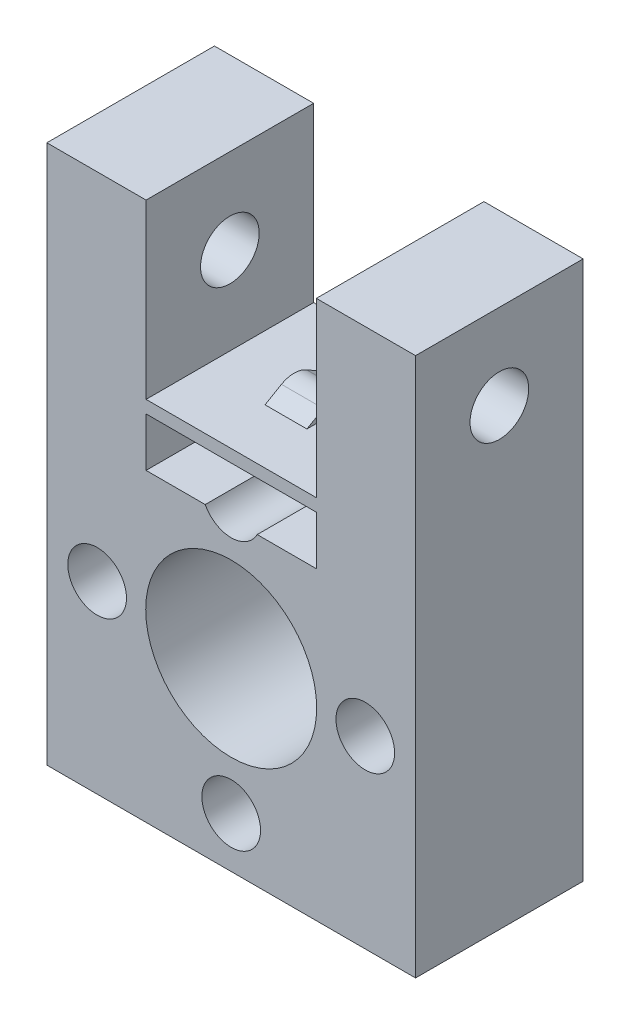
from build123d import *

# Parameters (mm, degrees)
SKETCH1_R                       = 11
SKETCH1_R_2                     = 5.1
BOSS_EXTRUDE1_DEPTH             = 10
SKETCH2_R                       = 1.75
CUT_EXTRUDE1_DEPTH              = 19.493242009
BOSS_EXTRUDE2_START             = 11
SKETCH3_W                       = 22
SKETCH3_H                       = 10
BOSS_EXTRUDE2_DEPTH             = 10.16
BOSS_EXTRUDE3_REACH             = 28.552
SKETCH5_W                       = 22
SKETCH5_H                       = 10
SKETCH6_W                       = 10.16
SKETCH6_H                       = 13.97
CUT_EXTRUDE2_DEPTH              = 26.860116009
SKETCH7_R                       = 1.75
CUT_EXTRUDE3_DEPTH              = 33.120797001
BOSS_EXTRUDE4_DEPTH             = 10
BOSS_EXTRUDE5_REACH             = 27.86
SKETCH9_W                       = 10
SKETCH9_H                       = 0.75
BOSS_EXTRUDE5_DIRECTION_2_REACH = 27.86
BOSS_EXTRUDE6_DEPTH             = 1.25
FILLET1_R                       = 1.5


with BuildPart() as part:
    # Sketch1 → Boss-Extrude1 (new body)
    with BuildSketch(Plane.XY):
        Circle(SKETCH1_R)
        Circle(SKETCH1_R_2, mode=Mode.SUBTRACT)
    extrude(amount=BOSS_EXTRUDE1_DEPTH)

    # Sketch2 → Cut-Extrude1 (cut, through all)
    with BuildSketch(Plane.XY.offset(10)):
        with Locations((0, 8)):
            Circle(SKETCH2_R)
        with Locations((8, 0)):
            Circle(SKETCH2_R)
        with Locations((0, -8)):
            Circle(SKETCH2_R)
        with Locations((-8, 0)):
            Circle(SKETCH2_R)
    extrude(amount=-CUT_EXTRUDE1_DEPTH, mode=Mode.SUBTRACT)

    # Sketch5 → Boss-Extrude3 (add, up to next)
    with BuildSketch(Plane.XZ.offset(-11), mode=Mode.PRIVATE) as boss_extrude3_sk1:
        with Locations((0, 5)):
            Rectangle(SKETCH5_W, SKETCH5_H)
    boss_extrude3_tool1 = extrude(boss_extrude3_sk1.sketch, amount=BOSS_EXTRUDE3_REACH, mode=Mode.PRIVATE) - part.part


with BuildPart() as body_2:
    # Sketch3 → Boss-Extrude2 (new body)
    with BuildSketch(Plane(origin=(0, 0, 0), x_dir=(1, 0, 0), z_dir=(0, 1, 0)).offset(BOSS_EXTRUDE2_START)):
        with Locations((0, -5)):
            Rectangle(SKETCH3_W, SKETCH3_H)
    extrude(amount=BOSS_EXTRUDE2_DEPTH)


with BuildPart() as part_1:
    add(part.part)

    add(body_2.part)  # Boss-Extrude3 merges body 2
    add(boss_extrude3_tool1.solids().sort_by_distance((0, 11, 5))[0])
    add(boss_extrude3_tool1.solids().sort_by_distance((0, 11, 5))[1])

    # Sketch6 → Cut-Extrude2 (cut, through all)
    with BuildSketch(Plane.XY.offset(10)):
        with Locations((0, 14.175)):
            Rectangle(SKETCH6_W, SKETCH6_H)
    extrude(amount=-CUT_EXTRUDE2_DEPTH, mode=Mode.SUBTRACT)

    # Sketch7 → Cut-Extrude3 (cut, through all)
    with BuildSketch(Plane(origin=(11, 0, 0), x_dir=(0, 0, -1), z_dir=(1, 0, 0))):
        with Locations((-5, 16.08)):
            Circle(SKETCH7_R)
    extrude(amount=-CUT_EXTRUDE3_DEPTH, mode=Mode.SUBTRACT)

    # Sketch8 → Boss-Extrude4 (add, through all)
    with BuildSketch(Plane.XY.offset(10)):
        with BuildLine():
            Line((-11, 0), (-11, -11))
            Line((-11, -11), (-4.5e-08, -11))
            ThreePointArc((-4.5e-08, -11), (-7.778174609, -7.778174577), (-11, 0))
        make_face()
        with BuildLine():
            ThreePointArc((11, 0), (7.778174577, -7.778174609), (-4.5e-08, -11))
            Line((-4.5e-08, -11), (11, -11))
            Line((11, -11), (11, 0))
        make_face()
    extrude(amount=-BOSS_EXTRUDE4_DEPTH)

    # Sketch9 → Boss-Extrude5 (add, up to next)
    with BuildSketch(Plane.ZY, mode=Mode.PRIVATE) as boss_extrude5_sk1:
        with Locations((5, 10.485)):
            Rectangle(SKETCH9_W, SKETCH9_H)
    boss_extrude5_tool1 = extrude(boss_extrude5_sk1.sketch, amount=BOSS_EXTRUDE5_REACH, mode=Mode.PRIVATE) - part_1.part
    add(boss_extrude5_tool1.solids().sort_by_distance((0, 10.485, 5))[0])

    # Sketch9 → Boss-Extrude5 direction 2 (add, up to next)
    with BuildSketch(Plane.ZY, mode=Mode.PRIVATE) as boss_extrude5_direction_2_sk1:
        with Locations((5, 10.485)):
            Rectangle(SKETCH9_W, SKETCH9_H)
    boss_extrude5_direction_2_tool1 = extrude(boss_extrude5_direction_2_sk1.sketch, amount=-BOSS_EXTRUDE5_DIRECTION_2_REACH, mode=Mode.PRIVATE) - part_1.part
    add(boss_extrude5_direction_2_tool1.solids().sort_by_distance((0, 10.485, 5))[0])

    # Sketch10 → Boss-Extrude6 (add, symmetric)
    with BuildSketch(Plane.ZY):
        Polygon((5, 11.86), (3.267949192, 10.86), (6.732050808, 10.86), align=None)
    extrude(amount=BOSS_EXTRUDE6_DEPTH, both=True)

    # Fillet1
    fillet1_edges = [part_1.edges().sort_by_distance(p)[0] for p in [
        (0, 11.86, 5),
    ]]
    fillet(fillet1_edges, radius=FILLET1_R)


solid = part_1.part
